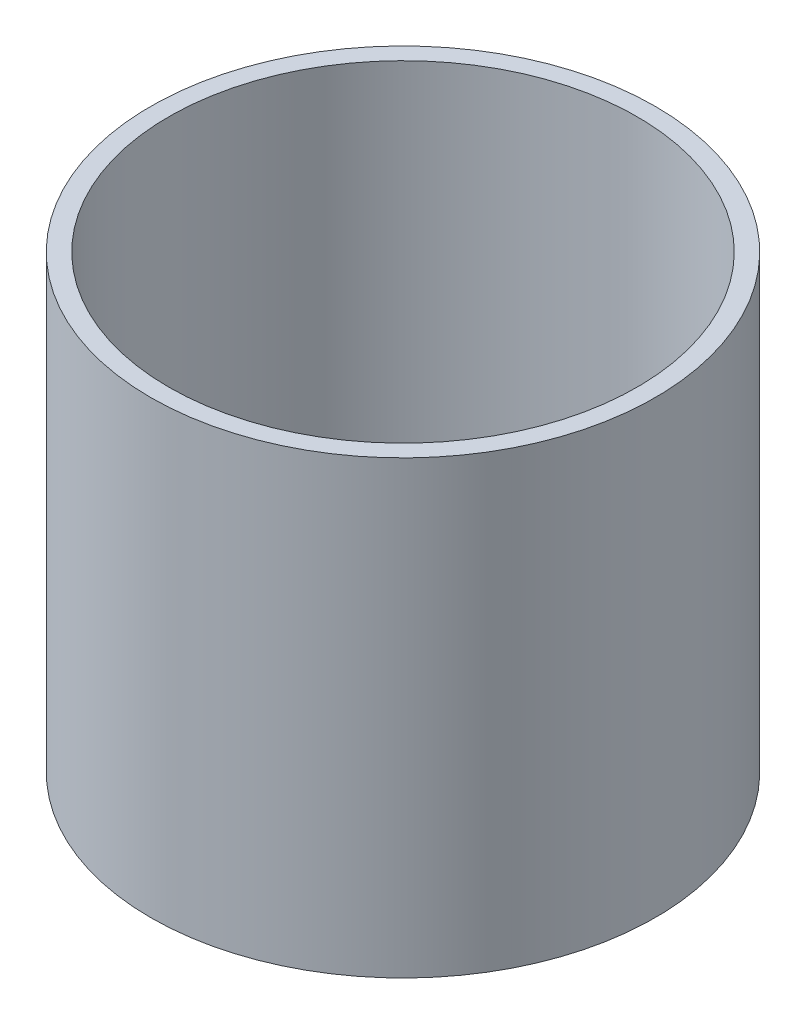
from build123d import *

# Parameters (mm, degrees)
SKETCH1_R           = 14
SKETCH1_R_2         = 13
BOSS_EXTRUDE1_DEPTH = 25


with BuildPart() as part:
    # Sketch1 → Boss-Extrude1 (new body)
    with BuildSketch(Plane(origin=(0, 0, 0), x_dir=(1, 0, 0), z_dir=(0, 1, 0))):
        with Locations(Location((0, 0, 0), (0, 0, 270))):
            Circle(SKETCH1_R)
        with Locations(Location((0, 0, 0), (0, 0, 270))):
            Circle(SKETCH1_R_2, mode=Mode.SUBTRACT)
    extrude(amount=BOSS_EXTRUDE1_DEPTH)


solid = part.part
